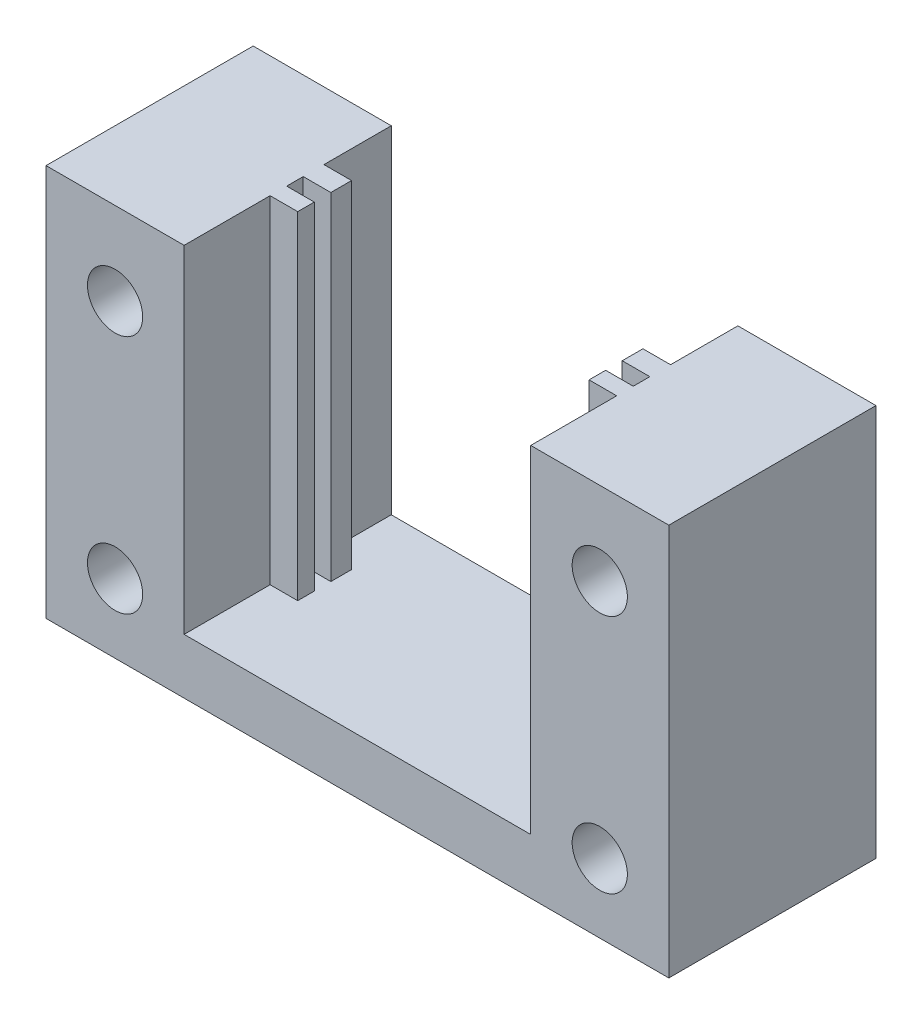
from build123d import *

# Parameters (mm, degrees)
ESQUISSE1_R             = 37
ESQUISSE1_R_2           = 1.5
ESQUISSE1_W             = 25
ESQUISSE1_H             = 3
BOSS_EXTRU_1_DEPTH      = 2
BOSS_EXTRU_2_DEPTH      = 15
ESQUISSE3_W             = 1.5
ESQUISSE3_H             = 28.4
ESQUISSE3_W_2           = 1.2
BOSS_EXTRU_3_DEPTH      = 2
ESQUISSE5_W             = 1.5
ESQUISSE5_H             = 24.4
ESQUISSE5_W_2           = 1.2
BOSS_EXTRU_4_DEPTH      = 2
ESQUISSE10_R            = 2
ENL_V_MAT_EXTRU_3_DEPTH = 49
ENL_V_START             = -2
ESQUISSE11_R            = 37
ENL_V_MAT_EXTRU_4_DEPTH = 2
SKETCH4_R               = 3.5
CUT_EXTRUDE2_DEPTH      = 3


with BuildPart() as part:
    # Esquisse1 → Boss.-Extru.1 (new body)
    with BuildSketch(Plane.XY):
        Circle(ESQUISSE1_R)
        with Locations((0, 30)):
            Circle(ESQUISSE1_R_2, mode=Mode.SUBTRACT)
        with Locations((-25.416453209, -15.9375)):
            Circle(ESQUISSE1_R_2, mode=Mode.SUBTRACT)
        with Locations((0, -27)):
            Circle(ESQUISSE1_R_2, mode=Mode.SUBTRACT)
        with Locations((25.416453209, -15.9375)):
            Circle(ESQUISSE1_R_2, mode=Mode.SUBTRACT)
        with Locations((0, -15.5)):
            Rectangle(ESQUISSE1_W, ESQUISSE1_H, mode=Mode.SUBTRACT)
    extrude(amount=BOSS_EXTRU_1_DEPTH)

    # Esquisse2 → Boss.-Extru.2 (add)
    with BuildSketch(Plane(origin=(0, 0, 0), x_dir=(-1, 0, 0), z_dir=(0, 0, -1))):
        Polygon((-22.55, 14.9), (-12.55, 14.9), (-12.55, -9.5), (12.55, -9.5), (12.55, 14.9), (22.55, 14.9), (22.55, -13.5), (-22.55, -13.5), align=None)
    extrude(amount=BOSS_EXTRU_2_DEPTH)

    # Esquisse3 → Boss.-Extru.3 (add)
    with BuildSketch(Plane(origin=(-12.55, 0, 0), x_dir=(0, 0, -1), z_dir=(1, 0, 0))):
        with Locations((9.375, 0.7)):
            Rectangle(ESQUISSE3_W, ESQUISSE3_H)
        with Locations((6.825, 0.7)):
            Rectangle(ESQUISSE3_W_2, ESQUISSE3_H)
    extrude(amount=BOSS_EXTRU_3_DEPTH)

    # Esquisse5 → Boss.-Extru.4 (add)
    with BuildSketch(Plane.ZY.offset(-12.55)):
        with Locations((-9.375, 2.7)):
            Rectangle(ESQUISSE5_W, ESQUISSE5_H)
        with Locations((-6.825, 2.7)):
            Rectangle(ESQUISSE5_W_2, ESQUISSE5_H)
    extrude(amount=BOSS_EXTRU_4_DEPTH)

    # Esquisse10 → Enlèv. mat.-Extru.3 (cut)
    with BuildSketch(Plane.XY.offset(2)):
        with Locations((-17.55, 8.9)):
            Circle(ESQUISSE10_R)
        with Locations((-17.55, -8.5)):
            Circle(ESQUISSE10_R)
        with Locations((17.55, -8.5)):
            Circle(ESQUISSE10_R)
        with Locations((17.55, 8.9)):
            Circle(ESQUISSE10_R)
    extrude(amount=-ENL_V_MAT_EXTRU_3_DEPTH, mode=Mode.SUBTRACT)

    # Esquisse11 → Enlèv. mat.-Extru.4 (cut)
    with BuildSketch(Plane.XY.offset(2).offset(ENL_V_START)):
        Circle(ESQUISSE11_R)
    extrude(amount=ENL_V_MAT_EXTRU_4_DEPTH, mode=Mode.SUBTRACT)

    # Sketch4 → Cut-Extrude2 (cut)
    with BuildSketch(Plane(origin=(0, 0, -15), x_dir=(-1, 0, 0), z_dir=(0, 0, -1))):
        with Locations((-17.55, -8.5)):
            Circle(SKETCH4_R)
        with Locations((-17.55, 8.9)):
            Circle(SKETCH4_R)
        with Locations((17.55, 8.9)):
            Circle(SKETCH4_R)
        with Locations((17.55, -8.5)):
            Circle(SKETCH4_R)
    extrude(amount=-CUT_EXTRUDE2_DEPTH, mode=Mode.SUBTRACT)


solid = part.part
